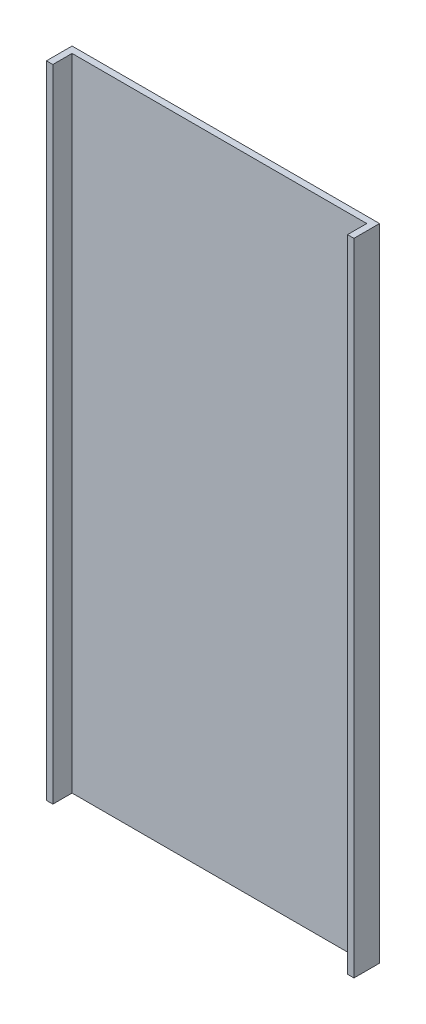
from build123d import *

# Parameters (mm, degrees)
AUFSATZ_LINEAR_AUSTRAGEN1_DEPTH = 1000


with BuildPart() as part:
    # Skizze1 → Aufsatz-Linear austragen1 (new body)
    with BuildSketch(Plane(origin=(0, 0, 0), x_dir=(1, 0, 0), z_dir=(0, 1, 0))):
        Polygon((0, 0), (10, 0), (10, 30), (470, 30), (470, 0), (480, 0), (480, 40), (0, 40), align=None)
    extrude(amount=AUFSATZ_LINEAR_AUSTRAGEN1_DEPTH)


solid = part.part
